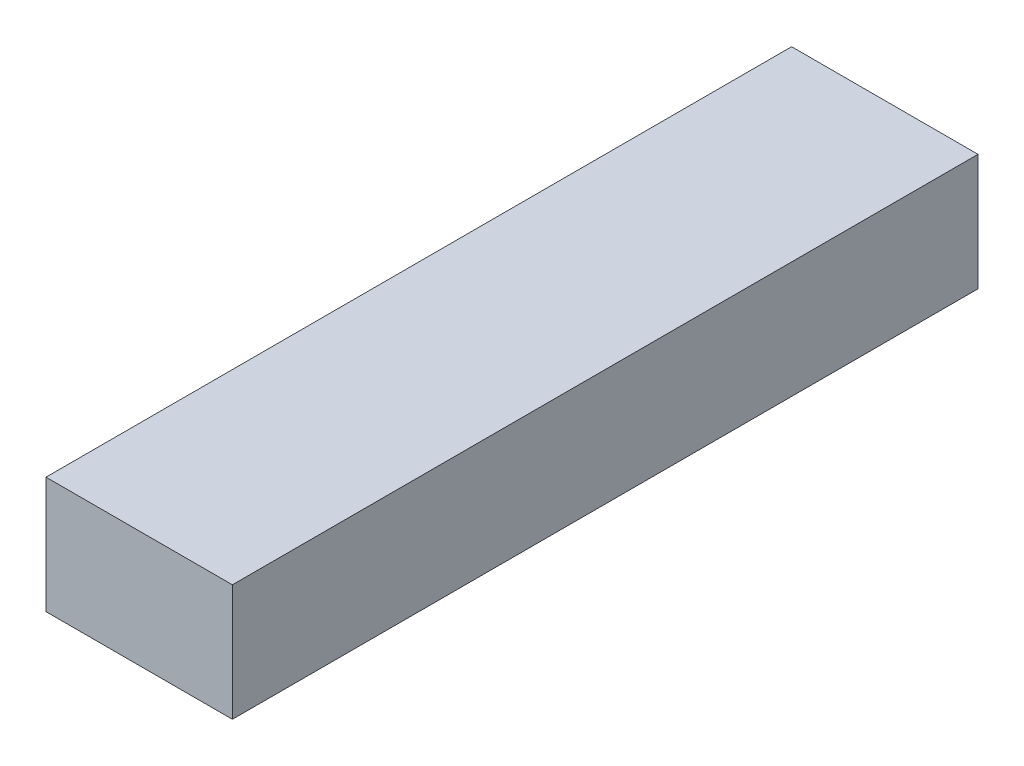
from build123d import *

# Parameters (mm, degrees)
SKETCH1_W           = 10.16
SKETCH1_H           = 40.64
BOSS_EXTRUDE1_DEPTH = 6.35


with BuildPart() as part:
    # Sketch1 → Boss-Extrude1 (new body)
    with BuildSketch(Plane(origin=(0, 0, 0), x_dir=(1, 0, 0), z_dir=(0, 1, 0))):
        Rectangle(SKETCH1_W, SKETCH1_H)
    extrude(amount=BOSS_EXTRUDE1_DEPTH)


solid = part.part
